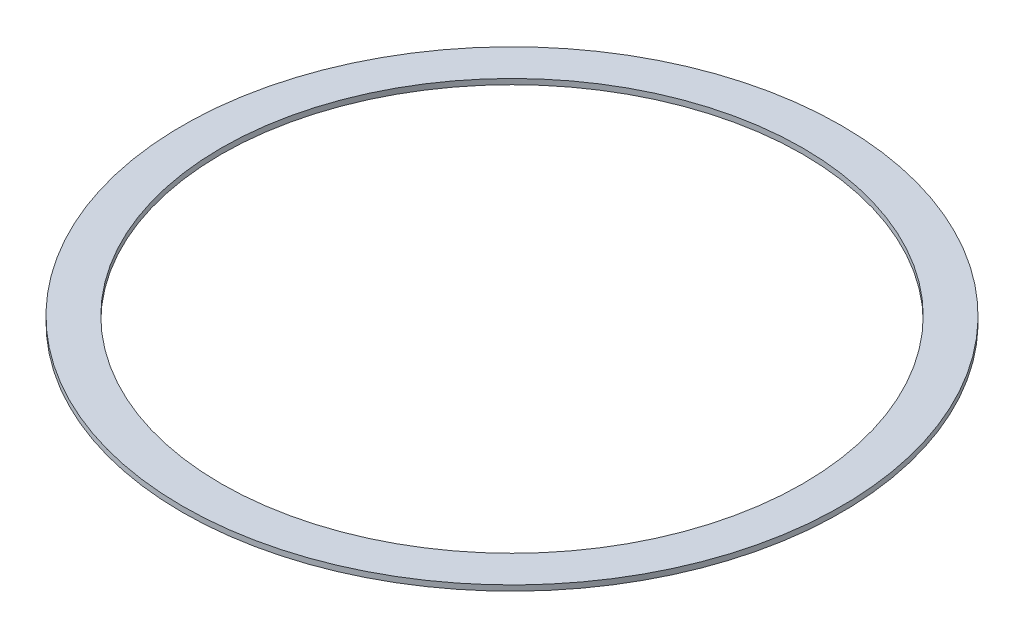
from build123d import *

# Parameters (mm, degrees)
SKETCH1_R           = 42.5
SKETCH1_R_2         = 37.5
BOSS_EXTRUDE1_DEPTH = 0.7


with BuildPart() as part:
    # Sketch1 → Boss-Extrude1 (new body)
    with BuildSketch(Plane(origin=(0, 0, 0), x_dir=(1, 0, 0), z_dir=(0, 1, 0))):
        with Locations(Location((0, 0, 0), (0, 0, 270))):
            Circle(SKETCH1_R)
        with Locations(Location((0, 0, 0), (0, 0, 270))):
            Circle(SKETCH1_R_2, mode=Mode.SUBTRACT)
    extrude(amount=BOSS_EXTRUDE1_DEPTH)


solid = part.part
